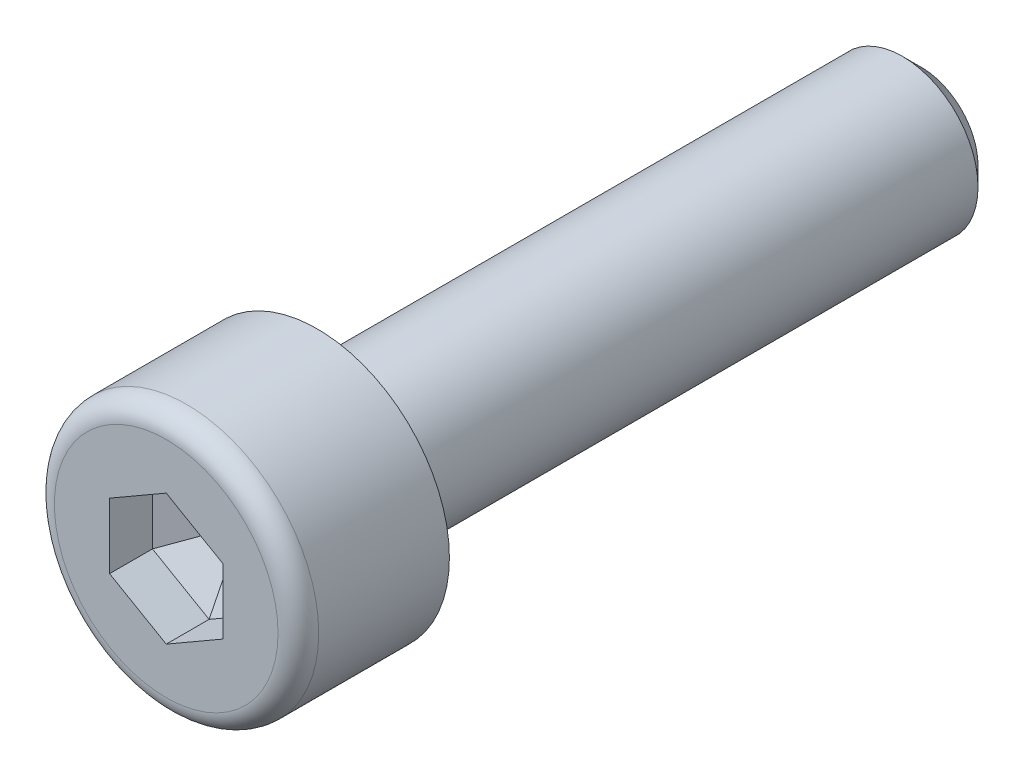
from build123d import *
from OCP.BRepFilletAPI import BRepFilletAPI_MakeChamfer

# Parameters (mm, degrees)
SKETCH_1_R          = 3.5
EXTRUDE_1_DEPTH     = 4
CUT_EXTRUDE_1_DEPTH = 2
SKETCH_3_R          = 2
EXTRUDE_2_DEPTH     = 16
CHAMFER_1_SIZE      = 0.5
FILLET_1_R          = 0.538461538
CHAMFER_2_SIZE      = 0.864553314
CHAMFER_2_SIZE2     = 1.497450266
FILLET_2_R          = 0.1


with BuildPart() as part:
    # 草图1 → 凸台-拉伸1 (new body)
    with BuildSketch(Plane.XY):
        Circle(SKETCH_1_R)
    extrude(amount=EXTRUDE_1_DEPTH)

    # 草图2 → 切除-拉伸1 (cut)
    with BuildSketch(Plane.XY.offset(4)):
        Polygon((1.5, 0.866025404), (0, 1.732050808), (-1.5, 0.866025404), (-1.5, -0.866025404), (0, -1.732050808), (1.5, -0.866025404), align=None)
    extrude(amount=-CUT_EXTRUDE_1_DEPTH, mode=Mode.SUBTRACT)

    # 草图3 → 凸台-拉伸2 (add)
    with BuildSketch(Plane(origin=(0, 0, 0), x_dir=(-1, 0, 0), z_dir=(0, 0, -1))):
        Circle(SKETCH_3_R)
    extrude(amount=EXTRUDE_2_DEPTH)

    # 倒角1
    chamfer_1_edges = [part.edges().sort_by_distance(p)[0] for p in [
        (2, 0, -16),
    ]]
    chamfer(chamfer_1_edges, length=CHAMFER_1_SIZE)

    # 圆角1
    fillet_1_edges = [part.edges().sort_by_distance(p)[0] for p in [
        (-3.5, 0, 4),
    ]]
    fillet(fillet_1_edges, radius=FILLET_1_R)

    # 倒角2: one chamfer whose edges measure the first distance from different faces: ONE call of the kernel's chamfer builder (chamfer() names one face for all edges)
    chamfer_2_edges_1 = [part.edges().sort_by_distance(p)[0] for p in [
        (-1.5, 0, 2),
    ]]
    chamfer_2_side_1 = [part.faces().sort_by_distance(p)[0] for p in [
        (-1.5, 0, 3),
    ]]
    chamfer_2_edges_2 = [part.edges().sort_by_distance(p)[0] for p in [
        (-0.75, 1.299038106, 2),
    ]]
    chamfer_2_side_2 = [part.faces().sort_by_distance(p)[0] for p in [
        (-0.75, 1.299038106, 3),
    ]]
    chamfer_2_edges_3 = [part.edges().sort_by_distance(p)[0] for p in [
        (0.75, 1.299038106, 2),
    ]]
    chamfer_2_side_3 = [part.faces().sort_by_distance(p)[0] for p in [
        (0.75, 1.299038106, 3),
    ]]
    chamfer_2_edges_4 = [part.edges().sort_by_distance(p)[0] for p in [
        (1.5, 0, 2),
    ]]
    chamfer_2_side_4 = [part.faces().sort_by_distance(p)[0] for p in [
        (1.5, 0, 3),
    ]]
    chamfer_2_edges_5 = [part.edges().sort_by_distance(p)[0] for p in [
        (-0.75, -1.299038106, 2),
    ]]
    chamfer_2_side_5 = [part.faces().sort_by_distance(p)[0] for p in [
        (-0.75, -1.299038106, 3),
    ]]
    chamfer_2_edges_6 = [part.edges().sort_by_distance(p)[0] for p in [
        (0.75, -1.299038106, 2),
    ]]
    chamfer_2_side_6 = [part.faces().sort_by_distance(p)[0] for p in [
        (0.75, -1.299038106, 3),
    ]]
    chamfer_2 = BRepFilletAPI_MakeChamfer(part.part.solid().wrapped)
    for e in chamfer_2_edges_1:
        chamfer_2.Add(CHAMFER_2_SIZE, CHAMFER_2_SIZE2, e.wrapped, chamfer_2_side_1[0].wrapped)  # the first distance lies on this face
    for e in chamfer_2_edges_2:
        chamfer_2.Add(CHAMFER_2_SIZE, CHAMFER_2_SIZE2, e.wrapped, chamfer_2_side_2[0].wrapped)  # the first distance lies on this face
    for e in chamfer_2_edges_3:
        chamfer_2.Add(CHAMFER_2_SIZE, CHAMFER_2_SIZE2, e.wrapped, chamfer_2_side_3[0].wrapped)  # the first distance lies on this face
    for e in chamfer_2_edges_4:
        chamfer_2.Add(CHAMFER_2_SIZE, CHAMFER_2_SIZE2, e.wrapped, chamfer_2_side_4[0].wrapped)  # the first distance lies on this face
    for e in chamfer_2_edges_5:
        chamfer_2.Add(CHAMFER_2_SIZE, CHAMFER_2_SIZE2, e.wrapped, chamfer_2_side_5[0].wrapped)  # the first distance lies on this face
    for e in chamfer_2_edges_6:
        chamfer_2.Add(CHAMFER_2_SIZE, CHAMFER_2_SIZE2, e.wrapped, chamfer_2_side_6[0].wrapped)  # the first distance lies on this face
    add(Compound.cast(chamfer_2.Shape()), mode=Mode.REPLACE)

    # 圆角2
    fillet_2_edges = [part.edges().sort_by_distance(p)[0] for p in [
        (2, 0, 0),
    ]]
    fillet(fillet_2_edges, radius=FILLET_2_R)


solid = part.part
